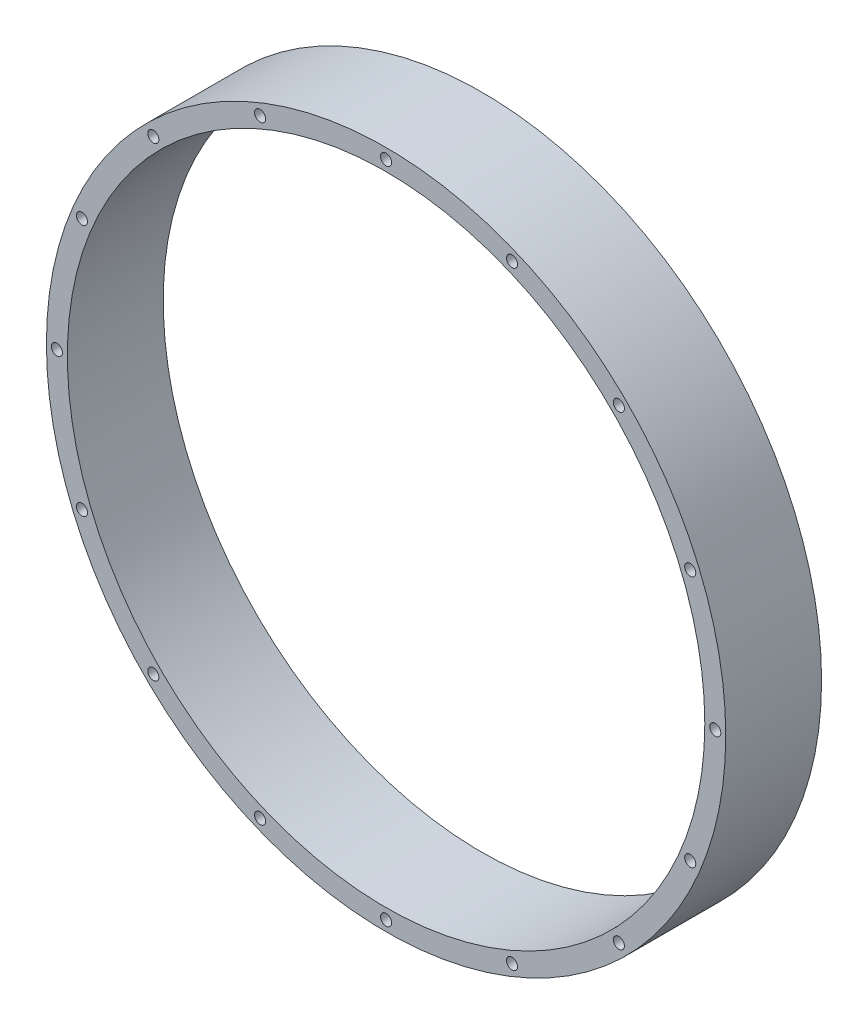
from build123d import *

# Parameters (mm, degrees)
SKETCH1_R           = 152.4
SKETCH1_R_2         = 143
BOSS_EXTRUDE1_DEPTH = 43
SKETCH1_3_R         = 2.4892
CUT_EXTRUDE1_DEPTH  = 220.773792796
CIRPATTERN1_COUNT   = 16


with BuildPart() as part:
    # Sketch1 → Boss-Extrude1 (new body)
    with BuildSketch(Plane(origin=(0, 0, 0), x_dir=(0, 1, 0), z_dir=(0, 0, 1))):
        Circle(SKETCH1_R)
        Circle(SKETCH1_R_2, mode=Mode.SUBTRACT)
    extrude(amount=-BOSS_EXTRUDE1_DEPTH)

    # Sketch1<3> → Cut-Extrude1 (cut, through all)
    with BuildSketch(Plane(origin=(0, 0, 0), x_dir=(0, 1, 0), z_dir=(0, 0, 1))):
        with Locations((0, 147.7)):
            Circle(SKETCH1_3_R)
    cut_extrude1 = extrude(amount=-CUT_EXTRUDE1_DEPTH, mode=Mode.SUBTRACT)

    # CirPattern1: Cut-Extrude1 ×16 about axis
    cirpattern1_axis = Axis((0, 0, -43), (0, 0, 1))
    for i in range(1, CIRPATTERN1_COUNT):
        add(cut_extrude1.rotate(cirpattern1_axis, i * 360 / CIRPATTERN1_COUNT), mode=Mode.SUBTRACT)


solid = part.part
